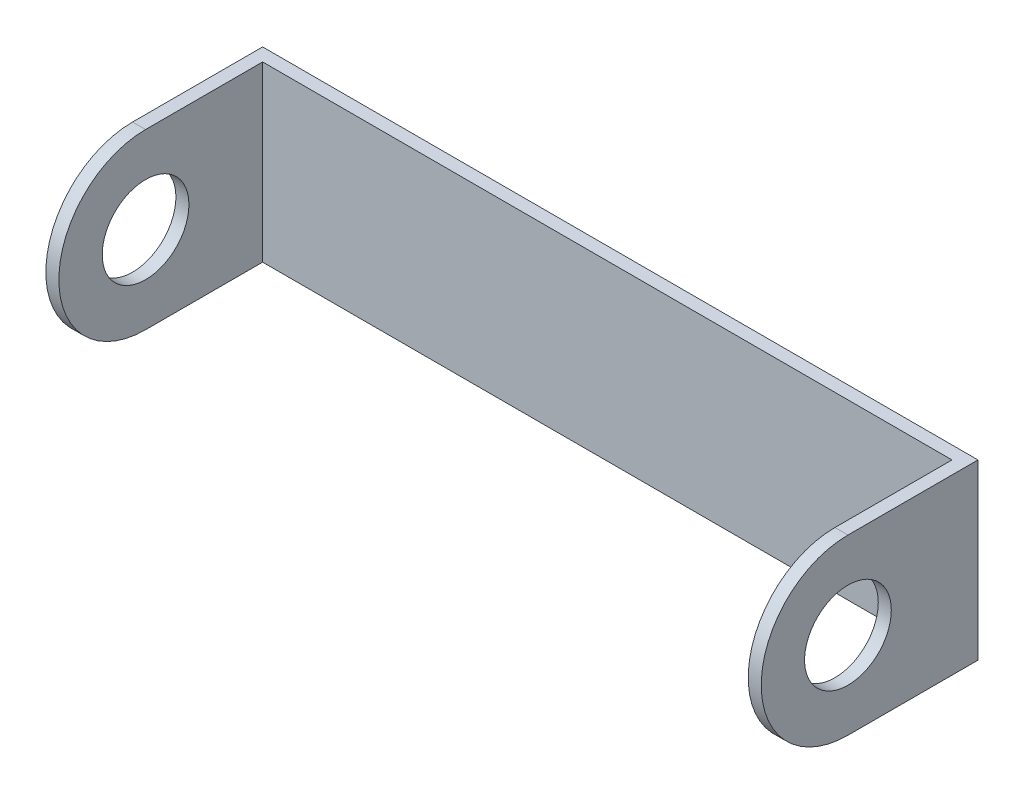
from build123d import *

# Parameters (mm, degrees)
SKETCH_1_W      = 3
SKETCH_1_H      = 40
EXTRUDE_1_DEPTH = 79.5
SKETCH_2_R      = 10
EXTRUDE_2_DEPTH = 3


with BuildPart() as part:
    # 스케치1 → 보스-돌출1 (new, symmetric)
    with BuildSketch(Plane(origin=(0, 0, 0), x_dir=(0, 0, -1), z_dir=(1, 0, 0))):
        with Locations((-1.5, 0)):
            Rectangle(SKETCH_1_W, SKETCH_1_H)
    extrude(amount=EXTRUDE_1_DEPTH, both=True)

    # 스케치2 → 보스-돌출2 (add)
    with BuildSketch(Plane(origin=(79.5, 0, 0), x_dir=(0, 0, -1), z_dir=(1, 0, 0))):
        with BuildLine():
            Line((0, 20), (-30, 20))
            ThreePointArc((-30, 20), (-50, 0), (-30, -20))
            Line((-30, -20), (0, -20))
            Line((0, -20), (0, 20))
        make_face()
        with Locations((-30, 0)):
            Circle(SKETCH_2_R, mode=Mode.SUBTRACT)
    extrude_2 = extrude(amount=EXTRUDE_2_DEPTH)

    # 대칭 복사1: 보스-돌출2 across plane
    add(extrude_2.mirror(Plane(origin=(0, 0, 0), x_dir=(0, 0, 1), z_dir=(1, 0, 0))))


solid = part.part
